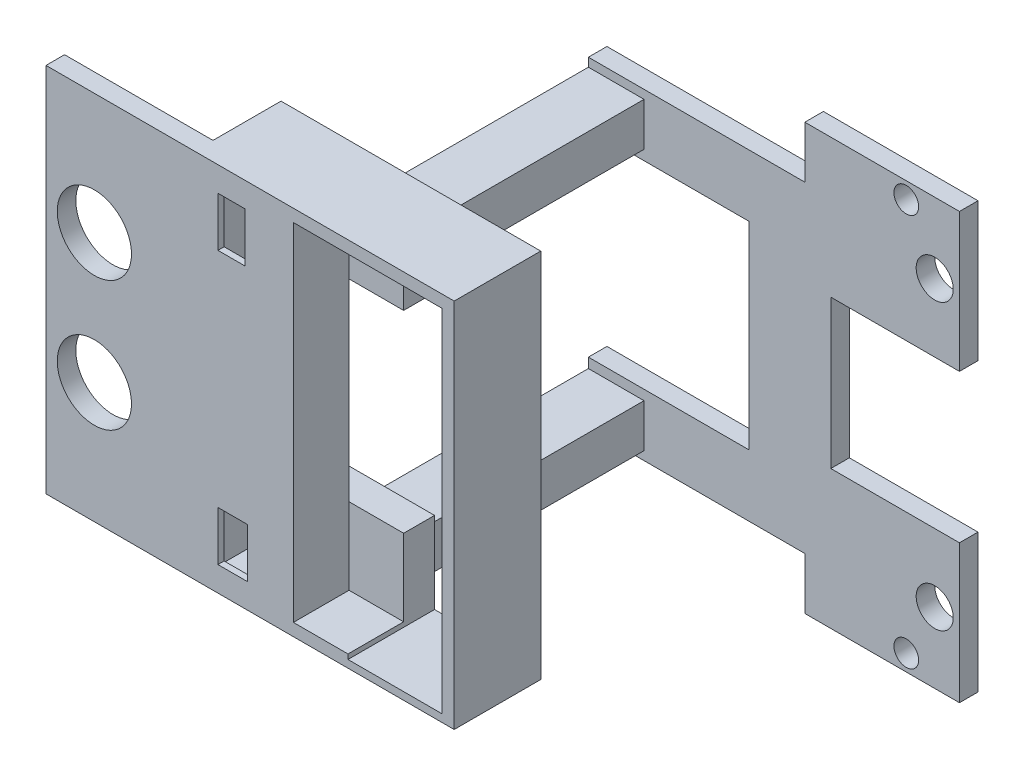
from build123d import *

# Parameters (mm, degrees)
SKETCH2_W           = 21
SKETCH2_H           = 30
BOSS_EXTRUDE1_DEPTH = 7
SKETCH3_W           = 12
SKETCH3_H           = 28
CUT_EXTRUDE1_DEPTH  = 4.5
SKETCH4_W           = 4.231229846
SKETCH4_H           = 28
CUT_EXTRUDE2_DEPTH  = 6.5
SKETCH8_W           = 7.5
SKETCH8_H           = 3.5
BOSS_EXTRUDE3_DEPTH = 17.5
SKETCH10_R          = 0.95
CUT_EXTRUDE4_DEPTH  = 3
SKETCH11_W          = 1.35
SKETCH11_H          = 3.5
SKETCH11_W_2        = 1.65
CUT_EXTRUDE5_DEPTH  = 17.5
SKETCH7_W           = 2.2
SKETCH7_H           = 4
SKETCH7_W_2         = 2.4
CUT_EXTRUDE6_DEPTH  = 2
SKETCH13_W          = 14.768770154
SKETCH13_H          = 15.6
CUT_EXTRUDE8_DEPTH  = 2.5
SKETCH14_W          = 7.585503546
SKETCH14_H          = 28.388252519
CUT_EXTRUDE9_DEPTH  = 10
SKETCH15_W          = 30
SKETCH15_H          = 34.4
BOSS_EXTRUDE4_DEPTH = 1.5
SKETCH16_W          = 13
SKETCH16_H          = 16
SKETCH16_W_2        = 17.5
SKETCH16_H_2        = 4.2
SKETCH16_W_3        = 10.4
SKETCH16_H_3        = 12
CUT_EXTRUDE10_DEPTH = 2
SKETCH17_R          = 1
SKETCH17_R_2        = 1.5
CUT_EXTRUDE11_DEPTH = 2
SKETCH18_W          = 1.5
SKETCH18_H          = 30
BOSS_EXTRUDE5_DEPTH = 12
SKETCH19_R          = 3
CUT_EXTRUDE12_DEPTH = 10


with BuildPart() as part:
    # Sketch2 → Boss-Extrude1 (new body)
    with BuildSketch(Plane.XY):
        Rectangle(SKETCH2_W, SKETCH2_H)
    extrude(amount=BOSS_EXTRUDE1_DEPTH)

    # Sketch3 → Cut-Extrude1 (cut)
    with BuildSketch(Plane.XY.offset(7)):
        with Locations((3.5, 0)):
            Rectangle(SKETCH3_W, SKETCH3_H)
    extrude(amount=-CUT_EXTRUDE1_DEPTH, mode=Mode.SUBTRACT)

    # Sketch4 → Cut-Extrude2 (cut)
    with BuildSketch(Plane(origin=(0, 0, 0), x_dir=(-1, 0, 0), z_dir=(0, 0, -1))):
        with Locations((7.384385077, 0)):
            Rectangle(SKETCH4_W, SKETCH4_H)
    extrude(amount=-CUT_EXTRUDE2_DEPTH, mode=Mode.SUBTRACT)

    # Sketch8 → Boss-Extrude3 (add)
    with BuildSketch(Plane(origin=(0, 0, 0), x_dir=(-1, 0, 0), z_dir=(0, 0, -1))):
        with Locations((0.75, 10.55)):
            Rectangle(SKETCH8_W, SKETCH8_H)
        with Locations((0.75, -10.55)):
            Rectangle(SKETCH8_W, SKETCH8_H)
    extrude(amount=BOSS_EXTRUDE3_DEPTH)

    # Sketch10 → Cut-Extrude4 (cut)
    with BuildSketch(Plane(origin=(0, 0, -17.5), x_dir=(-1, 0, 0), z_dir=(0, 0, -1))):
        with Locations((0.9, 10.55)):
            Circle(SKETCH10_R)
        with Locations(Location((0.9, -10.55, 0), (0, 0, 180))):
            Circle(SKETCH10_R)
    extrude(amount=-CUT_EXTRUDE4_DEPTH, mode=Mode.SUBTRACT)

    # Sketch11 → Cut-Extrude5 (cut)
    with BuildSketch(Plane(origin=(0, 0, -17.5), x_dir=(-1, 0, 0), z_dir=(0, 0, -1))):
        with Locations((3.825, -10.55)):
            Rectangle(SKETCH11_W, SKETCH11_H)
        with Locations((-2.175, -10.55)):
            Rectangle(SKETCH11_W_2, SKETCH11_H)
        with Locations((3.825, 10.55)):
            Rectangle(SKETCH11_W, SKETCH11_H)
        with Locations((-2.175, 10.55)):
            Rectangle(SKETCH11_W_2, SKETCH11_H)
    extrude(amount=-CUT_EXTRUDE5_DEPTH, mode=Mode.SUBTRACT)

    # Sketch7 → Cut-Extrude6 (cut)
    with BuildSketch(Plane.XY.offset(7)):
        with Locations((-7.5, 11)):
            Rectangle(SKETCH7_W, SKETCH7_H)
        with Locations((-7.4, -11)):
            Rectangle(SKETCH7_W_2, SKETCH7_H)
    extrude(amount=-CUT_EXTRUDE6_DEPTH, mode=Mode.SUBTRACT)

    # Sketch13 → Cut-Extrude8 (cut)
    with BuildSketch(Plane(origin=(0, 0, 0), x_dir=(-1, 0, 0), z_dir=(0, 0, -1))):
        with Locations((-2.115614923, 0)):
            Rectangle(SKETCH13_W, SKETCH13_H)
    extrude(amount=-CUT_EXTRUDE8_DEPTH, mode=Mode.SUBTRACT)

    # Sketch14 → Cut-Extrude9 (cut)
    with BuildSketch(Plane(origin=(0, 0, 0), x_dir=(-1, 0, 0), z_dir=(0, 0, -1))):
        with Locations((-5.707248227, -0.19412626)):
            Rectangle(SKETCH14_W, SKETCH14_H)
    extrude(amount=-CUT_EXTRUDE9_DEPTH, mode=Mode.SUBTRACT)

    # Sketch15 → Boss-Extrude4 (add)
    with BuildSketch(Plane(origin=(0, 0, -17.5), x_dir=(-1, 0, 0), z_dir=(0, 0, -1))):
        with Locations((-11.85, 0)):
            Rectangle(SKETCH15_W, SKETCH15_H)
    extrude(amount=BOSS_EXTRUDE4_DEPTH)

    # Sketch16 → Cut-Extrude10 (cut)
    with BuildSketch(Plane(origin=(0, 0, -19), x_dir=(-1, 0, 0), z_dir=(0, 0, -1))):
        with Locations((-3.35, 0)):
            Rectangle(SKETCH16_W, SKETCH16_H)
        with Locations((-5.6, -15.1)):
            Rectangle(SKETCH16_W_2, SKETCH16_H_2)
        with Locations((-5.6, 15.1)):
            Rectangle(SKETCH16_W_2, SKETCH16_H_2)
        with Locations((-21.65, 0)):
            Rectangle(SKETCH16_W_3, SKETCH16_H_3)
    extrude(amount=-CUT_EXTRUDE10_DEPTH, mode=Mode.SUBTRACT)

    # Sketch17 → Cut-Extrude11 (cut)
    with BuildSketch(Plane(origin=(0, 0, -19), x_dir=(-1, 0, 0), z_dir=(0, 0, -1))):
        with Locations((-22.55, -15.875)):
            Circle(SKETCH17_R)
        with Locations((-24.85, -11.5)):
            Circle(SKETCH17_R_2)
        with Locations((-22.55, 15.875)):
            Circle(SKETCH17_R)
        with Locations((-24.85, 11.5)):
            Circle(SKETCH17_R_2)
    extrude(amount=-CUT_EXTRUDE11_DEPTH, mode=Mode.SUBTRACT)

    # Sketch18 → Boss-Extrude5 (add)
    with BuildSketch(Plane.ZY.offset(10.5)):
        with Locations((6.25, 0)):
            Rectangle(SKETCH18_W, SKETCH18_H)
    extrude(amount=BOSS_EXTRUDE5_DEPTH)

    # Sketch19 → Cut-Extrude12 (cut)
    with BuildSketch(Plane(origin=(0, 0, 5.5), x_dir=(-1, 0, 0), z_dir=(0, 0, -1))):
        with Locations(Location((18.589045846, 5.243756264, 0), (0, 0, 90))):
            Circle(SKETCH19_R)
        with Locations(Location((18.589045846, -5.243756264, 0), (0, 0, 90))):
            Circle(SKETCH19_R)
    extrude(amount=-CUT_EXTRUDE12_DEPTH, mode=Mode.SUBTRACT)


solid = part.part
